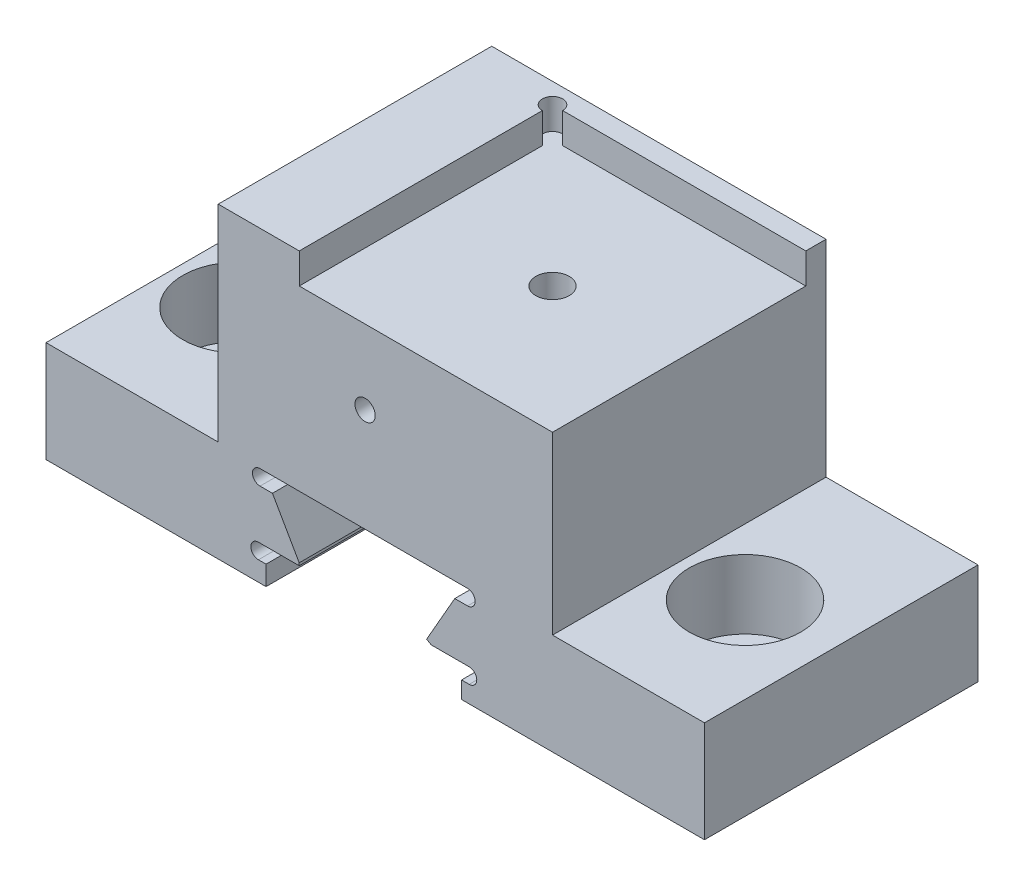
from build123d import *

# Parameters (mm, degrees)
SKETCH_1_W                = 29
SKETCH_1_H                = 29
EXTRUDE_1_DEPTH           = 5
SKETCH_2_W                = 25
SKETCH_2_H                = 25
CUT_EXTRUDE_1_DEPTH       = 3
SKETCH_3_W                = 35
SKETCH_3_H                = 29
EXTRUDE_756_DEPTH         = 25.341167732
HOLE_WIZARD_M4_1_D        = 3.3
HOLE_WIZARD_M4_1_DEPTH    = 10.1
HOLE_WIZARD_M4_1_TIP      = 0.991420021
SKETCH_9_R                = 1
CUT_EXTRUDE_2_DEPTH       = 3
SKETCH_11_W               = 29
SKETCH_11_H               = 5
EXTRUDE_4_DEPTH           = 6
CUT_EXTRUDE_8_DEPTH       = 40.383835
SKETCH_19_W               = 80
SKETCH_19_H               = 25
EXTRUDE_5_DEPTH           = 10
HOLE_WIZARD_1_D           = 6.6
HOLE_WIZARD_1_DEPTH       = 10.1
HOLE_WIZARD_1_CBORE_D     = 11
HOLE_WIZARD_1_CBORE_DEPTH = 6.8
HOLE_WIZARD_1_TIP         = 1.982840043
SKETCH_23_W               = 80
SKETCH_23_H               = 10
EXTRUDE_6_DEPTH           = 2
SKETCH_24_W               = 27
SKETCH_24_H               = 10
CUT_EXTRUDE_9_DEPTH       = 2
MM_1_D                    = 4
MM_1_DEPTH                = 5
MM_1_TIP                  = 1.201721238
CUT_EXTRUDE_10_DEPTH      = 5
SKETCH_28_R               = 1
CUT_EXTRUDE_11_DEPTH      = 2
HOLE_WIZARD_M6_1_D        = 5
HOLE_WIZARD_M6_1_DEPTH    = 10
HOLE_WIZARD_M6_1_TIP      = 1.502151548
CUT_EXTRUDE_12_DEPTH      = 62.837260656
CUT_EXTRUDE_12_DEPTH_BACK = 62.837260656
SKETCH_32_W               = 27
SKETCH_32_H               = 10
CUT_EXTRUDE_13_DEPTH      = 6.5
SKETCH_33_W               = 27
SKETCH_33_H               = 10
CUT_EXTRUDE_14_DEPTH      = 6.5
CUT_EXTRUDE_15_DEPTH      = 5
MM_2_D                    = 4
MM_2_DEPTH                = 5
MM_2_TIP                  = 1.201721238
MM_3_D                    = 4
MM_3_DEPTH                = 5
MM_3_TIP                  = 1.201721238


with BuildPart() as part:
    # 草图1 → 凸台-拉伸1 (new body)
    with BuildSketch(Plane(origin=(0, 0, 0), x_dir=(1, 0, 0), z_dir=(0, 1, 0))):
        Rectangle(SKETCH_1_W, SKETCH_1_H)
    extrude(amount=EXTRUDE_1_DEPTH)

    # 草图2 → 切除-拉伸1 (cut)
    with BuildSketch(Plane.XZ.offset(-5)):
        Rectangle(SKETCH_2_W, SKETCH_2_H)
    extrude(amount=CUT_EXTRUDE_1_DEPTH, mode=Mode.SUBTRACT)

    # 草图3 → Extrude 756 (add)
    with BuildSketch(Plane(origin=(0, 0, 0), x_dir=(-1, 0, 0), z_dir=(0, -1, 0))):
        with Locations((3, 0)):
            Rectangle(SKETCH_3_W, SKETCH_3_H)
    extrude(amount=EXTRUDE_756_DEPTH)

    # M4 螺纹孔1
    with Locations(Plane.ZX.offset(2)):
        with Locations((0, 0)):
            Hole(HOLE_WIZARD_M4_1_D / 2, depth=HOLE_WIZARD_M4_1_DEPTH)
            with Locations((0, 0, -(HOLE_WIZARD_M4_1_DEPTH + HOLE_WIZARD_M4_1_TIP / 2))):  # 118° drill point
                Cone(0, HOLE_WIZARD_M4_1_D / 2, HOLE_WIZARD_M4_1_TIP, mode=Mode.SUBTRACT)

    # 草图9 → 切除-拉伸2 (cut)
    with BuildSketch(Plane(origin=(0, 5, 0), x_dir=(1, 0, 0), z_dir=(0, 1, 0))):
        with Locations((-12.5, 12.5)):
            Circle(SKETCH_9_R)
    extrude(amount=-CUT_EXTRUDE_2_DEPTH, mode=Mode.SUBTRACT)

    # 草图11 → 凸台-拉伸4 (add)
    with BuildSketch(Plane.ZY.offset(14.5)):
        with Locations((0, 2.5)):
            Rectangle(SKETCH_11_W, SKETCH_11_H)
    extrude(amount=EXTRUDE_4_DEPTH)

    # 草图17 → 切除-拉伸8 (cut, through all)
    with BuildSketch(Plane(origin=(0, 5, 0), x_dir=(1, 0, 0), z_dir=(0, 1, 0))):
        Polygon((-20.5, -14.5), (14.5, -14.5), (14.5, 14.5), (12.5, 14.5), (12.5, -12.5), (-20.5, -12.5), align=None)
    extrude(amount=-CUT_EXTRUDE_8_DEPTH, mode=Mode.SUBTRACT)

    # 草图19 → 凸台-拉伸5 (add)
    with BuildSketch(Plane(origin=(0, -25.341167732, 0), x_dir=(-1, 0, 0), z_dir=(0, -1, 0))):
        with Locations((6, 0)):
            Rectangle(SKETCH_19_W, SKETCH_19_H)
    extrude(amount=-EXTRUDE_5_DEPTH)

    # 打孔尺寸(%根据)内六角圆柱头螺钉的类型1
    with Locations(Plane(origin=(-31, -15.341167732, 0), x_dir=(0, 0, 1), z_dir=(0, 1, 0))):
        with Locations((0, 0), (0, 50)):
            CounterBoreHole(HOLE_WIZARD_1_D / 2, HOLE_WIZARD_1_CBORE_D / 2, HOLE_WIZARD_1_CBORE_DEPTH, depth=HOLE_WIZARD_1_DEPTH)
            with Locations((0, 0, -(HOLE_WIZARD_1_DEPTH + HOLE_WIZARD_1_TIP / 2))):  # 118° drill point
                Cone(0, HOLE_WIZARD_1_D / 2, HOLE_WIZARD_1_TIP, mode=Mode.SUBTRACT)

    # 草图23 → 凸台-拉伸6 (add)
    with BuildSketch(Plane(origin=(0, 0, -12.5), x_dir=(-1, 0, 0), z_dir=(0, 0, -1))):
        with Locations((6, -20.341167732)):
            Rectangle(SKETCH_23_W, SKETCH_23_H)
    extrude(amount=EXTRUDE_6_DEPTH)

    # 草图24 → 切除-拉伸9 (cut)
    with BuildSketch(Plane.ZY.offset(46)):
        with Locations((-1, -20.341167732)):
            Rectangle(SKETCH_24_W, SKETCH_24_H)
    extrude(amount=-CUT_EXTRUDE_9_DEPTH, mode=Mode.SUBTRACT)

    # 大小mm 暗销孔1
    with Locations(Plane(origin=(-21, -25.341167732, 0), x_dir=(0, 0, -1), z_dir=(0, -1, 0))):
        with Locations((0, 0)):
            Hole(MM_1_D / 2, depth=MM_1_DEPTH)
            with Locations((0, 0, -(MM_1_DEPTH + MM_1_TIP / 2))):  # 118° drill point
                Cone(0, MM_1_D / 2, MM_1_TIP, mode=Mode.SUBTRACT)

    # 草图27 → 切除-拉伸10 (cut)
    with BuildSketch(Plane.XZ.offset(25.341167732)):
        with BuildLine():
            Line((8.5, 2), (9.5, 2))
            ThreePointArc((9.5, 2), (11.5, 0), (9.5, -2))
            Line((9.5, -2), (8.5, -2))
            ThreePointArc((8.5, -2), (6.5, 0), (8.5, 2))
        make_face()
    extrude(amount=-CUT_EXTRUDE_10_DEPTH, mode=Mode.SUBTRACT)

    # 草图28 → 切除-拉伸11 (cut)
    with BuildSketch(Plane.XY.offset(12.5)):
        with Locations((-6, -5.341167732)):
            Circle(SKETCH_28_R)
    extrude(amount=-CUT_EXTRUDE_11_DEPTH, mode=Mode.SUBTRACT)

    # M6 螺纹孔1
    with Locations(Plane(origin=(-6, -25.341167732, 0), x_dir=(0, 0, -1), z_dir=(0, -1, 0))):
        with Locations((0, 0)):
            Hole(HOLE_WIZARD_M6_1_D / 2, depth=HOLE_WIZARD_M6_1_DEPTH)
            with Locations((0, 0, -(HOLE_WIZARD_M6_1_DEPTH + HOLE_WIZARD_M6_1_TIP / 2))):  # 118° drill point
                Cone(0, HOLE_WIZARD_M6_1_D / 2, HOLE_WIZARD_M6_1_TIP, mode=Mode.SUBTRACT)

    # 草图31 → 切除-拉伸12 (cut, two sides: drawn at the far end of the back side and taken through both)
    with BuildSketch(Plane(origin=(-6.0032, 14.658832268, 10.4718), x_dir=(1, 0, 0), z_dir=(0, 0, 1)).offset(-CUT_EXTRUDE_12_DEPTH_BACK)):
        with BuildLine():
            Line((10.117055245, -31.7), (8.854085532, -31.7))
            Line((8.854085532, -31.7), (6.07517942, -36.564132504))
            Line((6.07517942, -36.564132504), (6.531795149, -36.824999624))
            Line((6.531795149, -36.824999624), (10.275, -36.824999624))
            ThreePointArc((10.275, -36.824999624), (11.025, -37.574999624), (10.275, -38.324999624))
            Line((10.275, -38.324999624), (9.525, -38.324999624))
            Line((9.525, -38.324999624), (9.525, -40))
            Line((9.525, -40), (-9.776101272, -40))
            Line((-9.776101272, -40), (-9.776101272, -38.074384714))
            Line((-9.776101272, -38.074384714), (-10.526101272, -38.074384714))
            ThreePointArc((-10.526101272, -38.074384714), (-11.276101272, -37.324384714), (-10.526101272, -36.574384714))
            Line((-10.526101272, -36.574384714), (-6.501264425, -36.574384714))
            Line((-6.501264425, -36.574384714), (-6.501264425, -36.324384714))
            Line((-6.501264425, -36.324384714), (-9.143201284, -31.7))
            Line((-9.143201284, -31.7), (-10.369175052, -31.7))
            ThreePointArc((-10.369175052, -31.7), (-11.119175052, -30.95), (-10.369175052, -30.2))
            Line((-10.369175052, -30.2), (10.117055245, -30.2))
            ThreePointArc((10.117055245, -30.2), (10.867055245, -30.95), (10.117055245, -31.7))
        make_face()
    extrude(amount=CUT_EXTRUDE_12_DEPTH + CUT_EXTRUDE_12_DEPTH_BACK, mode=Mode.SUBTRACT)

    # 草图32 → 切除-拉伸13 (cut)
    with BuildSketch(Plane.ZY.offset(44)):
        with Locations((-1, -20.341167732)):
            Rectangle(SKETCH_32_W, SKETCH_32_H)
    extrude(amount=-CUT_EXTRUDE_13_DEPTH, mode=Mode.SUBTRACT)

    # 草图33 → 切除-拉伸14 (cut)
    with BuildSketch(Plane(origin=(34, 0, 0), x_dir=(0, 0, -1), z_dir=(1, 0, 0))):
        with Locations((1, -20.341167732)):
            Rectangle(SKETCH_33_W, SKETCH_33_H)
    extrude(amount=-CUT_EXTRUDE_14_DEPTH, mode=Mode.SUBTRACT)

    # 草图35 → 切除-拉伸15 (cut)
    with BuildSketch(Plane.XZ.offset(25.341167732)):
        with BuildLine():
            Line((8.5, -6), (9.5, -6))
            ThreePointArc((9.5, -6), (11.5, -8), (9.5, -10))
            Line((9.5, -10), (8.5, -10))
            ThreePointArc((8.5, -10), (6.5, -8), (8.5, -6))
        make_face()
    extrude(amount=-CUT_EXTRUDE_15_DEPTH, mode=Mode.SUBTRACT)

    # 大小mm 暗销孔2
    with Locations(Plane(origin=(-21, -25.341167732, -8), x_dir=(0, 0, -1), z_dir=(0, -1, 0))):
        with Locations((0, 0)):
            Hole(MM_2_D / 2, depth=MM_2_DEPTH)
            with Locations((0, 0, -(MM_2_DEPTH + MM_2_TIP / 2))):  # 118° drill point
                Cone(0, MM_2_D / 2, MM_2_TIP, mode=Mode.SUBTRACT)

    # 大小mm 暗销孔3
    with Locations(Plane(origin=(-21, -25.341167732, 8), x_dir=(0, 0, -1), z_dir=(0, -1, 0))):
        with Locations((0, 0)):
            Hole(MM_3_D / 2, depth=MM_3_DEPTH)
            with Locations((0, 0, -(MM_3_DEPTH + MM_3_TIP / 2))):  # 118° drill point
                Cone(0, MM_3_D / 2, MM_3_TIP, mode=Mode.SUBTRACT)


solid = part.part
